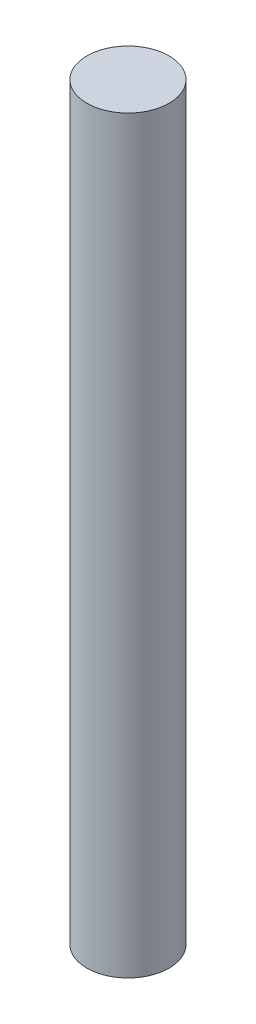
from build123d import *

# Parameters (mm, degrees)
SKETCH1_R           = 4.7625
BOSS_EXTRUDE1_DEPTH = 86.825


with BuildPart() as part:
    # Sketch1 → Boss-Extrude1 (new body)
    with BuildSketch(Plane(origin=(0, 0, 0), x_dir=(1, 0, 0), z_dir=(0, 1, 0))):
        with Locations(Location((0, 0, 0), (0, 0, 270))):
            Circle(SKETCH1_R)
    extrude(amount=BOSS_EXTRUDE1_DEPTH)


solid = part.part
